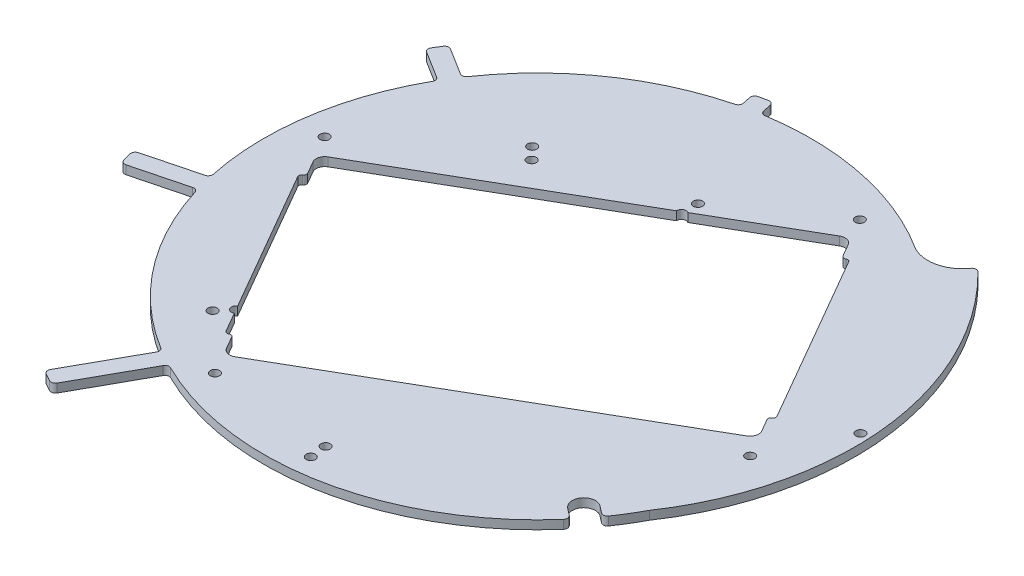
from build123d import *

# Parameters (mm, degrees)
SKIZZE3_R                       = 1.6
AUFSATZ_LINEAR_AUSTRAGEN2_DEPTH = 3


with BuildPart() as part:
    # Skizze3 → Aufsatz-Linear austragen2 (new body)
    with BuildSketch(Plane(origin=(0, 0, 0), x_dir=(1, 0, 0), z_dir=(0, 1, 0))):
        with BuildLine():
            Line((-22.920228343, 96.629088178), (-22.344299626, 93.816420414))
            ThreePointArc((-22.344299626, 93.816420414), (-22.542717442, 92.719074618), (-23.44364655, 92.061910889))
            ThreePointArc((-23.44364655, 92.061910889), (-54.271856221, 77.97156932), (-78.191055718, 53.955155506))
            ThreePointArc((-78.191055718, 53.955155506), (-79.120725207, 53.338399316), (-80.219076246, 53.534099474))
            Line((-80.219076246, 53.534099474), (-89.501191513, 59.319472491))
            ThreePointArc((-89.501191513, 59.319472491), (-90.633712755, 59.507661551), (-91.567595966, 58.839917861))
            Line((-91.567595966, 58.839917861), (-93.154445785, 56.293958781))
            ThreePointArc((-93.154445785, 56.293958781), (-93.342634844, 55.161437539), (-92.674891154, 54.22755433))
            Line((-92.674891154, 54.22755433), (-83.39277588, 48.44218132))
            ThreePointArc((-83.39277588, 48.44218132), (-82.733338177, 47.542283842), (-82.877606996, 46.436001751))
            ThreePointArc((-82.877606996, 46.436001751), (-93.904857786, 14.383243174), (-92.977009936, -19.500656997))
            ThreePointArc((-92.977009936, -19.500656997), (-93.170481392, -20.599402805), (-94.069039172, -21.260664834))
            Line((-94.069039172, -21.260664834), (-112.45901324, -26.02283492))
            ThreePointArc((-112.45901324, -26.02283492), (-113.375668635, -26.714038487), (-113.535087151, -27.850966463))
            Line((-113.535087151, -27.850966463), (-112.78302952, -30.755171917))
            ThreePointArc((-112.78302952, -30.755171917), (-112.091825953, -31.671827312), (-110.954897977, -31.831245829))
            Line((-110.954897977, -31.831245829), (-92.56492391, -27.069075743))
            ThreePointArc((-92.56492391, -27.069075743), (-91.458351408, -27.211099875), (-90.755907088, -28.077844089))
            ThreePointArc((-90.755907088, -28.077844089), (-75.123446485, -58.150389407), (-49.929025507, -80.821361112))
            ThreePointArc((-49.929025507, -80.821361112), (-49.266012044, -81.71862735), (-49.405877469, -82.825474774))
            Line((-49.405877469, -82.825474774), (-62.541801916, -106.490431951))
            ThreePointArc((-62.541801916, -106.490431951), (-62.672436625, -107.631025681), (-61.958287752, -108.529919931))
            Line((-61.958287752, -108.529919931), (-59.335285607, -109.985893746))
            ThreePointArc((-59.335285607, -109.985893746), (-58.194691877, -110.116528455), (-57.295797627, -109.402379582))
            Line((-57.295797627, -109.402379582), (-44.159873181, -85.737422405))
            ThreePointArc((-44.159873181, -85.737422405), (-43.294500776, -85.033288783), (-42.182335236, -85.121387406))
            ThreePointArc((-42.182335236, -85.121387406), (18.550993294, -93.171136345), (71.569296393, -62.47268054))
            ThreePointArc((71.569296393, -62.47268054), (71.9321762, -61.340716002), (71.357484514, -60.300160894))
            Line((71.357484514, -60.300160894), (68.971387619, -58.452957067))
            ThreePointArc((68.971387619, -58.452957067), (68.257042933, -52.841387619), (73.868612381, -52.127042933))
            Line((73.868612381, -52.127042933), (76.254709276, -53.97424676))
            ThreePointArc((76.254709276, -53.97424676), (77.40605957, -54.269912054), (78.411007457, -53.635006381))
            ThreePointArc((78.411007457, -53.635006381), (81.195601848, -49.318092427), (83.742774792, -44.856969025))
            add(Edge.make_bspline(
                [(83.742774792, -44.856969025), (85.080044201, -42.885733183), (86.342723056, -40.864226462), (90.475393107, -33.658708882), (92.941125683, -28.24523113), (96.845107593, -17.06419167), (98.283381771, -11.296742285), (100.106464604, 0.398106312), (100.491415891, 6.325362035), (100.215805302, 18.151824424), (99.555347906, 24.050820899), (97.228067455, 35.64317623), (95.561517803, 41.336299316), (91.289247265, 52.354443321), (88.683550867, 57.679431674), (82.621810162, 67.817630372), (79.16582226, 72.63078095), (73.343896748, 79.470957727), (71.24767403, 81.729158793), (69.059455254, 83.893875883)],
                knots=[0.068742517, 0.068742517, 0.068742517, 0.068742517, 0.0703125, 0.0703125, 0.07421875, 0.07421875, 0.078125, 0.078125, 0.08203125, 0.08203125, 0.0859375, 0.0859375, 0.08984375, 0.08984375, 0.09375, 0.09375, 0.09765625, 0.09765625, 0.099693464, 0.099693464, 0.099693464, 0.099693464], degree=3))
            ThreePointArc((69.059455254, 83.893875883), (67.867659856, 84.321246531), (66.773383158, 83.684394547))
            ThreePointArc((66.773383158, 83.684394547), (59.654132804, 78.863219836), (51.13982414, 80.060716878))
            ThreePointArc((51.13982414, 80.060716878), (19.451120952, 92.98738567), (-14.761966333, 93.846067312))
            ThreePointArc((-14.761966333, 93.846067312), (-15.84949093, 94.09499262), (-16.464348853, 95.025918661))
            Line((-16.464348853, 95.025918661), (-17.041794218, 97.835985787))
            ThreePointArc((-17.041794218, 97.835985787), (-17.68563769, 98.786504104), (-18.813021723, 99.003355966))
            Line((-18.813021723, 99.003355966), (-21.752647244, 98.399287425))
            ThreePointArc((-21.752647244, 98.399287425), (-22.702876664, 97.75588212), (-22.920228343, 96.629088178))
        make_face()
        with Locations(Location((-84.889727457, 11.033320997, 0), (0, 0, 270))):
            Circle(SKIZZE3_R, mode=Mode.SUBTRACT)
        with Locations(Location((32.889727457, 79.033320997, 0), (0, 0, 270))):
            Circle(SKIZZE3_R, mode=Mode.SUBTRACT)
        with Locations(Location((84.889727457, -11.033320997, 0), (0, 0, 270))):
            Circle(SKIZZE3_R, mode=Mode.SUBTRACT)
        with Locations(Location((-32.889727457, -79.033320997, 0), (0, 0, 270))):
            Circle(SKIZZE3_R, mode=Mode.SUBTRACT)
        with Locations(Location((97.25, 14.9, 0), (0, 0, 270))):
            Circle(SKIZZE3_R, mode=Mode.SUBTRACT)
        with Locations(Location((8.32, -81.84, 0), (0, 0, 270))):
            Circle(SKIZZE3_R, mode=Mode.SUBTRACT)
        with Locations(Location((-42, 40, 0), (0, 0, 270))):
            Circle(SKIZZE3_R, mode=Mode.SUBTRACT)
        with Locations(Location((0, 55.75, 0), (0, 0, 270))):
            Circle(SKIZZE3_R, mode=Mode.SUBTRACT)
        with Locations(Location((-45.965517241, 44.163793104, 0), (0, 0, 270))):
            Circle(SKIZZE3_R, mode=Mode.SUBTRACT)
        with Locations(Location((-52.075687148, -60.652605619, 0), (0, 0, 270))):
            Circle(SKIZZE3_R, mode=Mode.SUBTRACT)
        with Locations(Location((8.901557721, -87.560514891, 0), (0, 0, 270))):
            Circle(SKIZZE3_R, mode=Mode.SUBTRACT)
        with BuildLine():
            Line((-1.595893079, 49.88543439), (-78.291651246, 5.605117767))
            ThreePointArc((-78.291651246, 5.605117767), (-79.689428725, 3.78349869), (-79.389727457, 1.507041555))
            Line((-79.389727457, 1.507041555), (-76.889727457, -2.823085464))
            ThreePointArc((-76.889727457, -2.823085464), (-76.789827035, -3.581904509), (-77.255752861, -4.189110868))
            ThreePointArc((-77.255752861, -4.189110868), (-77.721678687, -4.796317226), (-77.621778265, -5.555136271))
            Line((-77.621778265, -5.555136271), (-49.129993275, -54.904355472))
            ThreePointArc((-49.129993275, -54.904355472), (-49.715633921, -57.089996118), (-47.529993275, -57.675636764))
            Line((-47.529993275, -57.675636764), (-43.621778265, -64.444863729))
            ThreePointArc((-43.621778265, -64.444863729), (-43.014571906, -64.910789555), (-42.255752861, -64.810889132))
            ThreePointArc((-42.255752861, -64.810889132), (-41.496933816, -64.71098871), (-40.889727457, -65.176914536))
            Line((-40.889727457, -65.176914536), (-38.389727457, -69.507041555))
            ThreePointArc((-38.389727457, -69.507041555), (-36.568108381, -70.904819034), (-34.291651246, -70.605117767))
            Line((-34.291651246, -70.605117767), (78.291651246, -5.605117767))
            ThreePointArc((78.291651246, -5.605117767), (79.689428725, -3.78349869), (79.389727457, -1.507041555))
            Line((79.389727457, -1.507041555), (76.889727457, 2.823085464))
            ThreePointArc((76.889727457, 2.823085464), (76.789827035, 3.581904509), (77.255752861, 4.189110868))
            ThreePointArc((77.255752861, 4.189110868), (77.721678687, 4.796317226), (77.621778265, 5.555136271))
            Line((77.621778265, 5.555136271), (43.621778265, 64.444863729))
            ThreePointArc((43.621778265, 64.444863729), (43.014571906, 64.910789555), (42.255752861, 64.810889132))
            ThreePointArc((42.255752861, 64.810889132), (41.496933816, 64.71098871), (40.889727457, 65.176914536))
            Line((40.889727457, 65.176914536), (38.389727457, 69.507041555))
            ThreePointArc((38.389727457, 69.507041555), (36.568108381, 70.904819034), (34.291651246, 70.605117767))
            Line((34.291651246, 70.605117767), (0.897163269, 51.324801143))
            ThreePointArc((0.897163269, 51.324801143), (-0.8, 51.385640646), (-1.595893079, 49.88543439))
        make_face(mode=Mode.SUBTRACT)
    extrude(amount=AUFSATZ_LINEAR_AUSTRAGEN2_DEPTH)


solid = part.part
